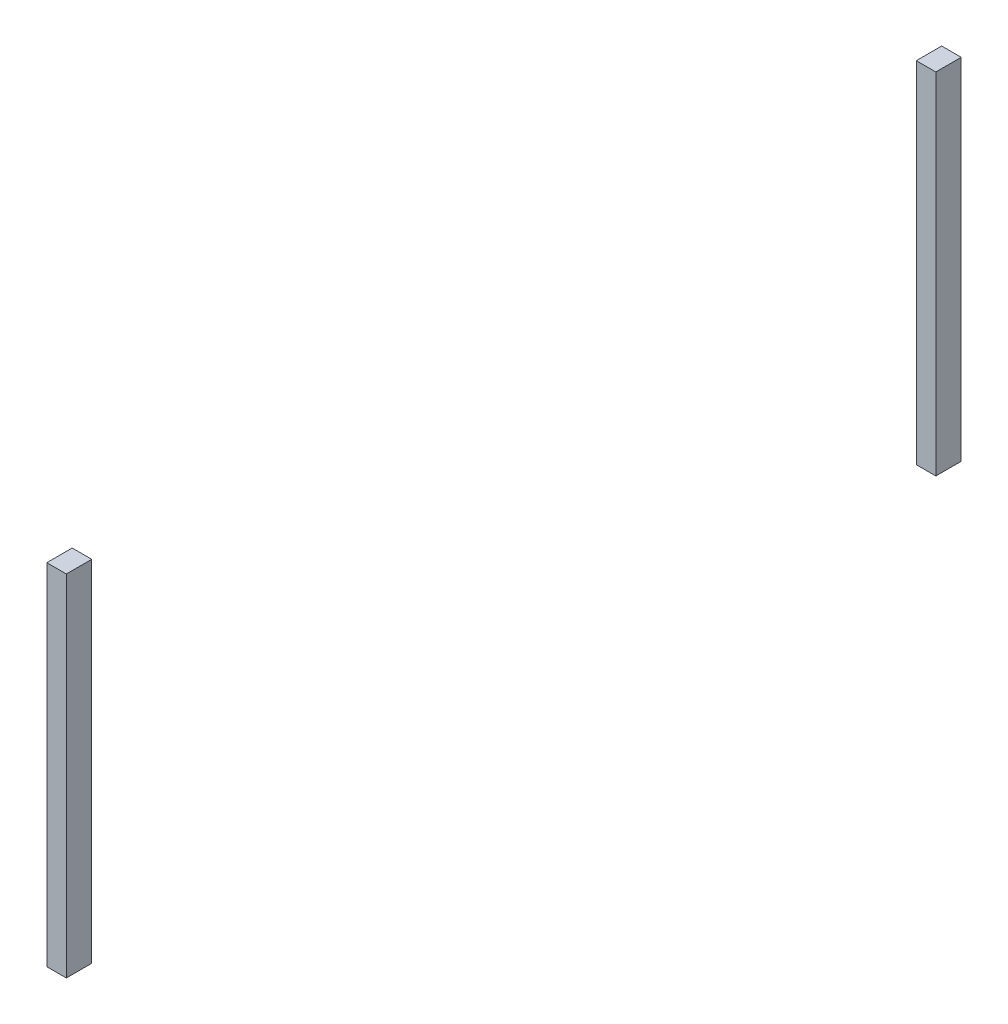
from build123d import *

# Parameters (mm, degrees)
SKETCH5_W           = 40
SKETCH5_H           = 551
BOSS_EXTRUDE2_DEPTH = 30.8
SKETCH10_W          = 40
SKETCH10_H          = 551
BOSS_EXTRUDE3_DEPTH = 30.8


with BuildPart() as part:
    # Sketch5 → Boss-Extrude2 (new body)
    with BuildSketch(Plane(origin=(-256.75, 0, 0), x_dir=(0, 0, -1), z_dir=(1, 0, 0))):
        with Locations((-1950.8, -124.5)):
            Rectangle(SKETCH5_W, SKETCH5_H)
    extrude(amount=-BOSS_EXTRUDE2_DEPTH)


with BuildPart() as body_2:
    # Sketch10 → Boss-Extrude3 (new body)
    with BuildSketch(Plane(origin=(-256.75, 0, 0), x_dir=(0, 0, -1), z_dir=(1, 0, 0))):
        with Locations((-581.6, -124.5)):
            Rectangle(SKETCH10_W, SKETCH10_H)
    extrude(amount=-BOSS_EXTRUDE3_DEPTH)


solid = Compound([part.part, body_2.part])
